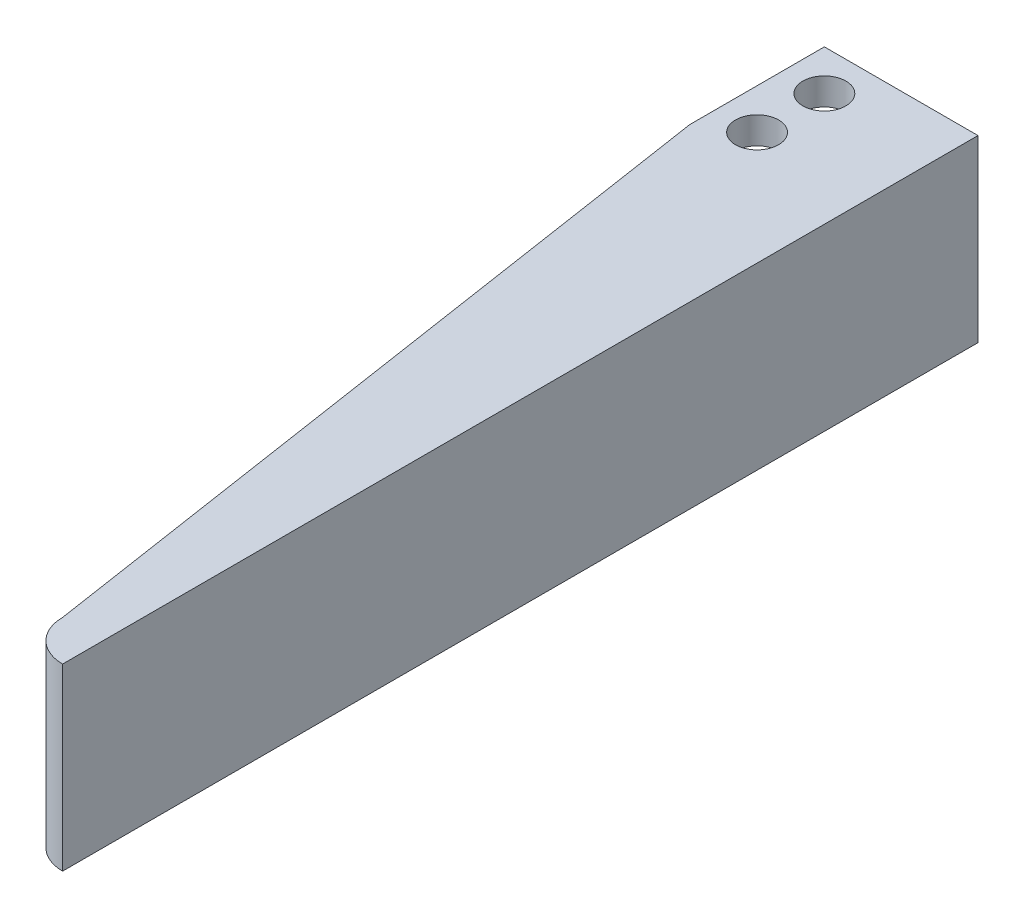
from build123d import *

# Parameters (mm, degrees)
SKETCH1_R           = 1.6
BOSS_EXTRUDE1_DEPTH = 2
BOSS_EXTRUDE2_START = 4.6625
BOSS_EXTRUDE2_DEPTH = 4.6625


with BuildPart() as part:
    # Sketch1 → Boss-Extrude1 (new body)
    with BuildSketch(Plane(origin=(0, 0, 0), x_dir=(1, 0, 0), z_dir=(0, 1, 0))):
        with BuildLine():
            Line((-5.70625, 0), (5.70625, 0))
            Line((5.70625, 0), (5.70625, -68))
            ThreePointArc((5.70625, -68), (3.584929656, -67.121320344), (2.70625, -65))
            Line((2.70625, -65), (-5.70625, -10))
            Line((-5.70625, -10), (-5.70625, 0))
        make_face()
        with Locations(Location((-2.70625, -3, 0), (0, 0, 270))):
            Circle(SKETCH1_R, mode=Mode.SUBTRACT)
        with Locations(Location((-2.70625, -8, 0), (0, 0, 270))):
            Circle(SKETCH1_R, mode=Mode.SUBTRACT)
    boss_extrude1 = extrude(amount=BOSS_EXTRUDE1_DEPTH)

    # Sketch2 → Boss-Extrude2 (add)
    with BuildSketch(Plane.XZ.offset(BOSS_EXTRUDE2_START)):
        with BuildLine():
            Line((5.70625, 68), (5.70625, 0))
            Line((5.70625, 0), (2.70625, 0))
            Line((2.70625, 0), (2.70625, 65))
            ThreePointArc((2.70625, 65), (3.584929656, 67.121320344), (5.70625, 68))
        make_face()
    boss_extrude2 = extrude(amount=-BOSS_EXTRUDE2_DEPTH)

    # Mirror6: Boss-Extrude2 across plane
    add(boss_extrude2.mirror(Plane(origin=(0, -4.6625, 0), x_dir=(0, 0, 1), z_dir=(0, -1, 0))))

    # Mirror7: Boss-Extrude1 across plane
    add(boss_extrude1.mirror(Plane(origin=(0, -4.6625, 0), x_dir=(0, 0, 1), z_dir=(0, -1, 0))))


solid = part.part
